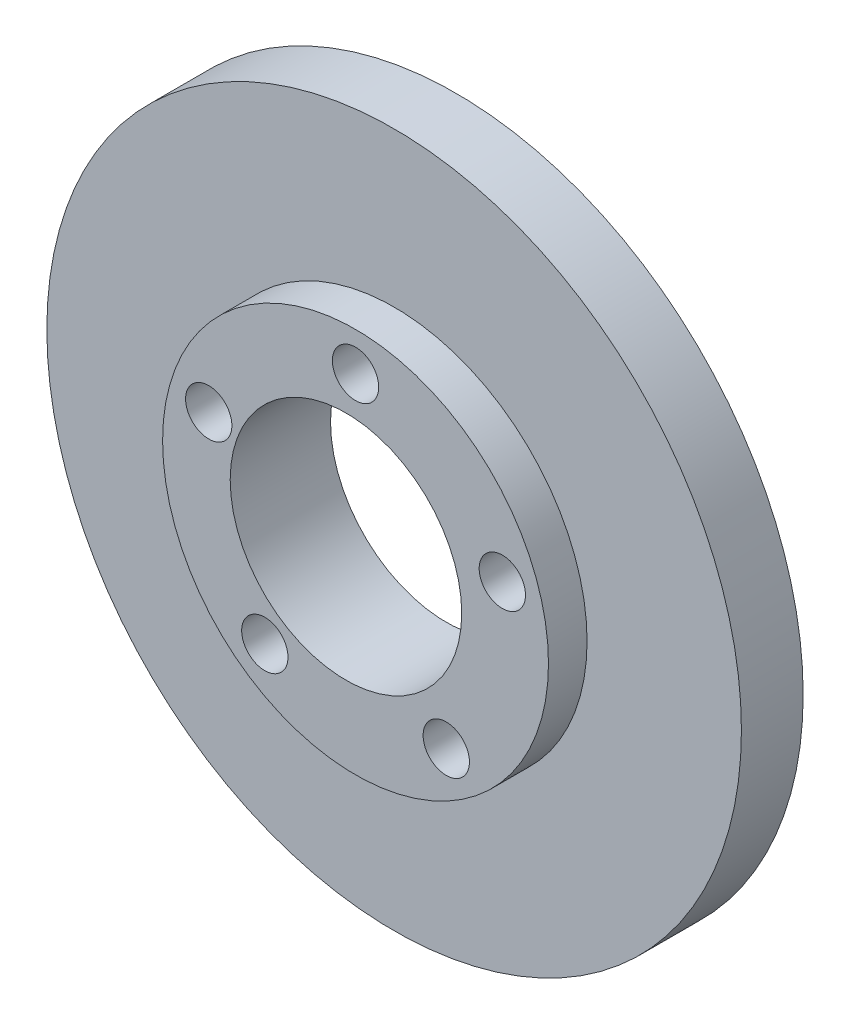
from build123d import *

# Parameters (mm, degrees)
SKETCH1_R                  = 90
SKETCH1_R_2                = 30
BOSS_EXTRUDE1_DEPTH        = 8
SKETCH2_R                  = 50
SKETCH2_R_2                = 30
BOSS_EXTRUDE2_DEPTH        = 10
F_12_0_12_DIAMETER_HOLE1_D = 12


with BuildPart() as part:
    # Sketch1 → Boss-Extrude1 (new, symmetric)
    with BuildSketch(Plane.XY):
        Circle(SKETCH1_R)
        with Locations((-2.481799725, 0)):
            Circle(SKETCH1_R_2, mode=Mode.SUBTRACT)
    extrude(amount=BOSS_EXTRUDE1_DEPTH, both=True)

    # Sketch2 → Boss-Extrude2 (add)
    with BuildSketch(Plane.XY.offset(8)):
        Circle(SKETCH2_R)
        with Locations((-2.481799725, 0)):
            Circle(SKETCH2_R_2, mode=Mode.SUBTRACT)
    extrude(amount=BOSS_EXTRUDE2_DEPTH)

    # Ø12.0 (12) Diameter Hole1 (through all)
    with Locations(Plane(origin=(0, 40, 18), x_dir=(1, 0, 0), z_dir=(0, 0, 1))):
        with Locations((0, 0), (-38.042260652, -27.639320225), (-23.511410092, -72.360679775), (23.511410092, -72.360679775), (38.042260652, -27.639320225)):
            Hole(F_12_0_12_DIAMETER_HOLE1_D / 2)


solid = part.part
